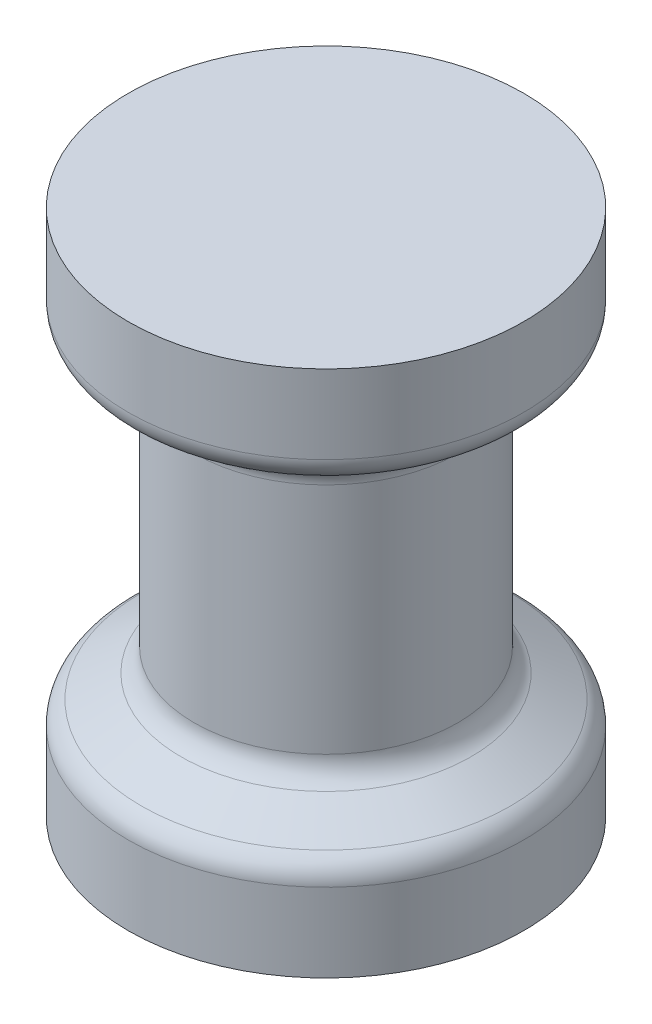
from build123d import *

# Parameters (mm, degrees)
FILLET1_R = 1
FILLET2_R = 1


with BuildPart() as part:
    # Sketch2 → Revolve1 (revolve)
    with BuildSketch(Plane(origin=(0, 0, 0), x_dir=(0, 0, -1), z_dir=(1, 0, 0)), mode=Mode.PRIVATE) as revolve1_sk:
        Polygon((0, 10), (-7.5, 10), (-7.5, 6.443375673), (-5, 5), (-5, -5), (-7.5, -6.443375673), (-7.5, -10), (0, -10), align=None)
    revolve(revolve1_sk.sketch.rotate(Axis((0, -42.375, 0), (0, 1, 0)), 180), axis=Axis((0, -42.375, 0), (0, 1, 0)))

    # Fillet1
    fillet1_edges = [part.edges().sort_by_distance(p)[0] for p in [
        (0, 5, 5),
        (0, -5, 5),
    ]]
    fillet(fillet1_edges, radius=FILLET1_R)

    # Fillet2
    fillet2_edges = [part.edges().sort_by_distance(p)[0] for p in [
        (0, 6.443375673, 7.5),
        (0, -6.443375673, 7.5),
    ]]
    fillet(fillet2_edges, radius=FILLET2_R)


solid = part.part
